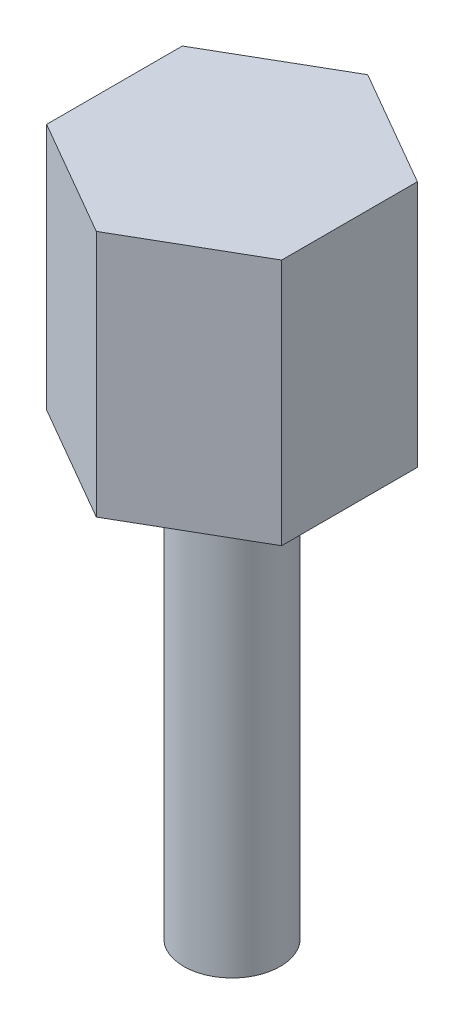
from build123d import *

# Parameters (mm, degrees)
SKETCH2_R           = 0.78
BOSS_EXTRUDE1_DEPTH = 7
BOSS_EXTRUDE2_DEPTH = 4


with BuildPart() as part:
    # Sketch2 → Boss-Extrude1 (new body)
    with BuildSketch(Plane(origin=(0, 0, 0), x_dir=(1, 0, 0), z_dir=(0, 1, 0))):
        with Locations(Location((0, 0, 0), (0, 0, 270))):
            Circle(SKETCH2_R)
    extrude(amount=BOSS_EXTRUDE1_DEPTH)

    # Sketch3 → Boss-Extrude2 (add)
    with BuildSketch(Plane(origin=(0, 7, 0), x_dir=(1, 0, 0), z_dir=(0, 1, 0))):
        Polygon((1.9, 1.096965511), (0, 2.193931023), (-1.9, 1.096965511), (-1.9, -1.096965511), (0, -2.193931023), (1.9, -1.096965511), align=None)
    extrude(amount=BOSS_EXTRUDE2_DEPTH)


solid = part.part
